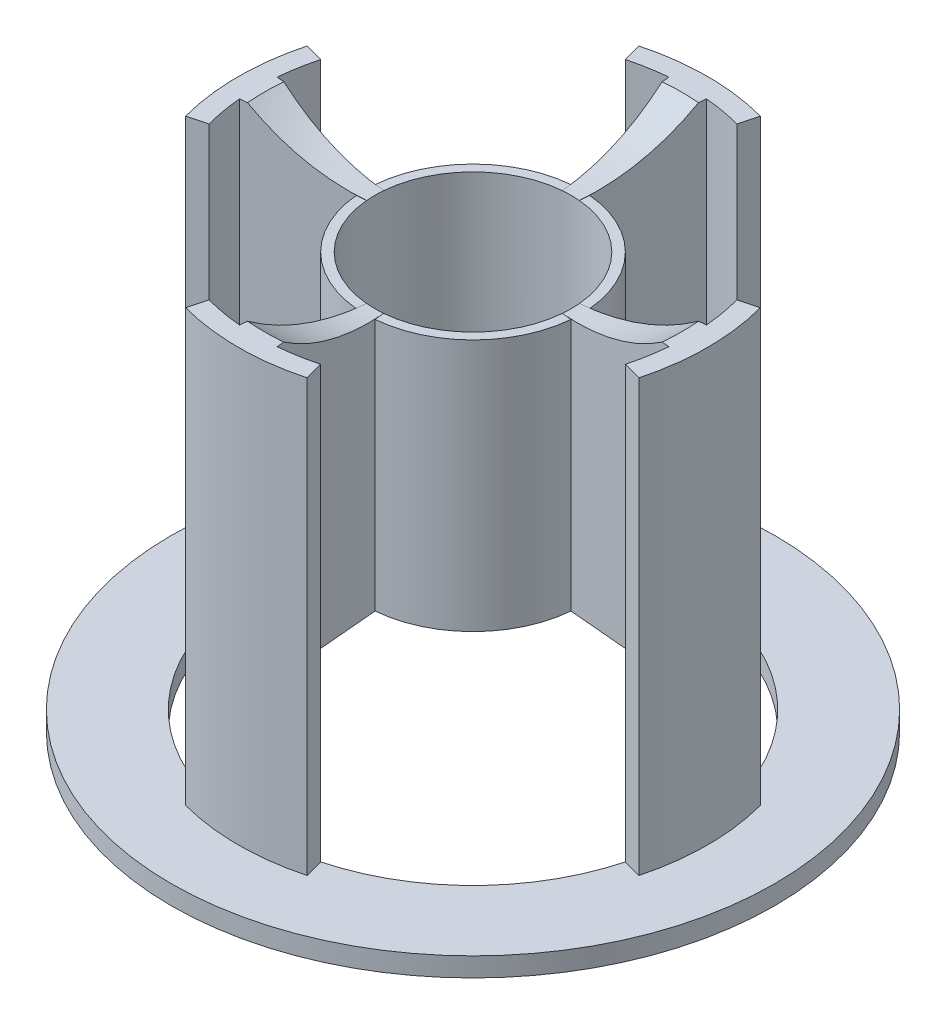
from build123d import *

# Parameters (mm, degrees)
ESBO_O1_R                = 31.5
ESBO_O1_R_2              = 22.5
RESSALTO_EXTRUS_O1_DEPTH = 2
RESSALTO_EXTRUS_O2_DEPTH = 45
REVOLU_O1_ANGLE          = 10
PADR_OCIRCULAR1_COUNT    = 2
PADR_OCIRCULAR1_ANGLE    = 90
ESBO_O5_R                = 11.25
ESBO_O5_R_2              = 10.25
RESSALTO_EXTRUS_O3_DEPTH = 26.37477


with BuildPart() as part:
    # Esboço1 → Ressalto-extrusão1 (new body)
    with BuildSketch(Plane(origin=(0, 0, 0), x_dir=(1, 0, 0), z_dir=(0, 1, 0))):
        with Locations(Location((0, 0, 0), (0, 0, 270))):
            Circle(ESBO_O1_R)
        with Locations(Location((0, 0, 0), (0, 0, 270))):
            Circle(ESBO_O1_R_2, mode=Mode.SUBTRACT)
    extrude(amount=RESSALTO_EXTRUS_O1_DEPTH)

    # Esboço3 → Ressalto-extrusão2 (add)
    with BuildSketch(Plane(origin=(0, 2, 0), x_dir=(1, 0, 0), z_dir=(0, 1, 0))):
        with BuildLine():
            Line((-5.823428515, -21.733331092), (-6.341066605, -23.665182744))
            ThreePointArc((-6.341066605, -23.665182744), (0, -24.5), (6.341066605, -23.665182744))
            Line((6.341066605, -23.665182744), (5.823428515, -21.733331092))
            ThreePointArc((5.823428515, -21.733331092), (0, -22.5), (-5.823428515, -21.733331092))
        make_face()
        with BuildLine():
            Line((-21.733331092, -5.823428515), (-23.665182744, -6.341066605))
            ThreePointArc((-23.665182744, -6.341066605), (-24.5, 0), (-23.665182744, 6.341066605))
            Line((-23.665182744, 6.341066605), (-21.733331092, 5.823428515))
            ThreePointArc((-21.733331092, 5.823428515), (-22.5, 0), (-21.733331092, -5.823428515))
        make_face()
        with BuildLine():
            Line((-5.823428515, 21.733331092), (-6.341066605, 23.665182744))
            ThreePointArc((-6.341066605, 23.665182744), (0, 24.5), (6.341066605, 23.665182744))
            Line((6.341066605, 23.665182744), (5.823428515, 21.733331092))
            ThreePointArc((5.823428515, 21.733331092), (0, 22.5), (-5.823428515, 21.733331092))
        make_face()
        with BuildLine():
            Line((21.733331092, 5.823428515), (23.665182744, 6.341066605))
            ThreePointArc((23.665182744, 6.341066605), (24.5, 0), (23.665182744, -6.341066605))
            Line((23.665182744, -6.341066605), (21.733331092, -5.823428515))
            ThreePointArc((21.733331092, -5.823428515), (22.5, 0), (21.733331092, 5.823428515))
        make_face()
    extrude(amount=RESSALTO_EXTRUS_O2_DEPTH)

    # Esboço4 → Revolução1 (revolve, symmetric)
    with BuildSketch(Plane.XY) as revolu_o1_sk:
        with BuildLine():
            Line((-24.5, 47), (-21.733331092, 47))
            ThreePointArc((-21.733331092, 47), (-16.270987924, 44.302599501), (-10.25, 43.374770442))
            Line((-10.25, 43.374770442), (-10.25, 17))
            Line((-10.25, 17), (-24.5, 17))
            Line((-24.5, 17), (-24.5, 47))
        make_face()
        with BuildLine():
            Line((10.25, 17), (24.5, 17))
            Line((24.5, 17), (24.5, 47))
            Line((24.5, 47), (21.733331092, 47))
            ThreePointArc((21.733331092, 47), (16.270987924, 44.302599501), (10.25, 43.374770442))
            Line((10.25, 43.374770442), (10.25, 17))
        make_face()
    revolu_o1 = revolve(axis=Axis((0, 0, 0), (0, 1, 0)), revolution_arc=REVOLU_O1_ANGLE / 2)
    revolu_o1 = revolu_o1 + revolve(revolu_o1_sk.sketch, axis=Axis((0, 0, 0), (0, -1, 0)), revolution_arc=REVOLU_O1_ANGLE / 2)

    # PadrãoCircular1: Revolução1 ×2 about axis
    padr_ocircular1_axis = Axis((0, 0, 0), (0, 1, 0))
    for i in range(1, PADR_OCIRCULAR1_COUNT):
        add(revolu_o1.rotate(padr_ocircular1_axis, i * PADR_OCIRCULAR1_ANGLE / (PADR_OCIRCULAR1_COUNT - 1)))

    # Esboço5 → Ressalto-extrusão3 (add)
    with BuildSketch(Plane.XZ.offset(-17)):
        Circle(ESBO_O5_R)
        Circle(ESBO_O5_R_2, mode=Mode.SUBTRACT)
    extrude(amount=-RESSALTO_EXTRUS_O3_DEPTH)


solid = part.part
